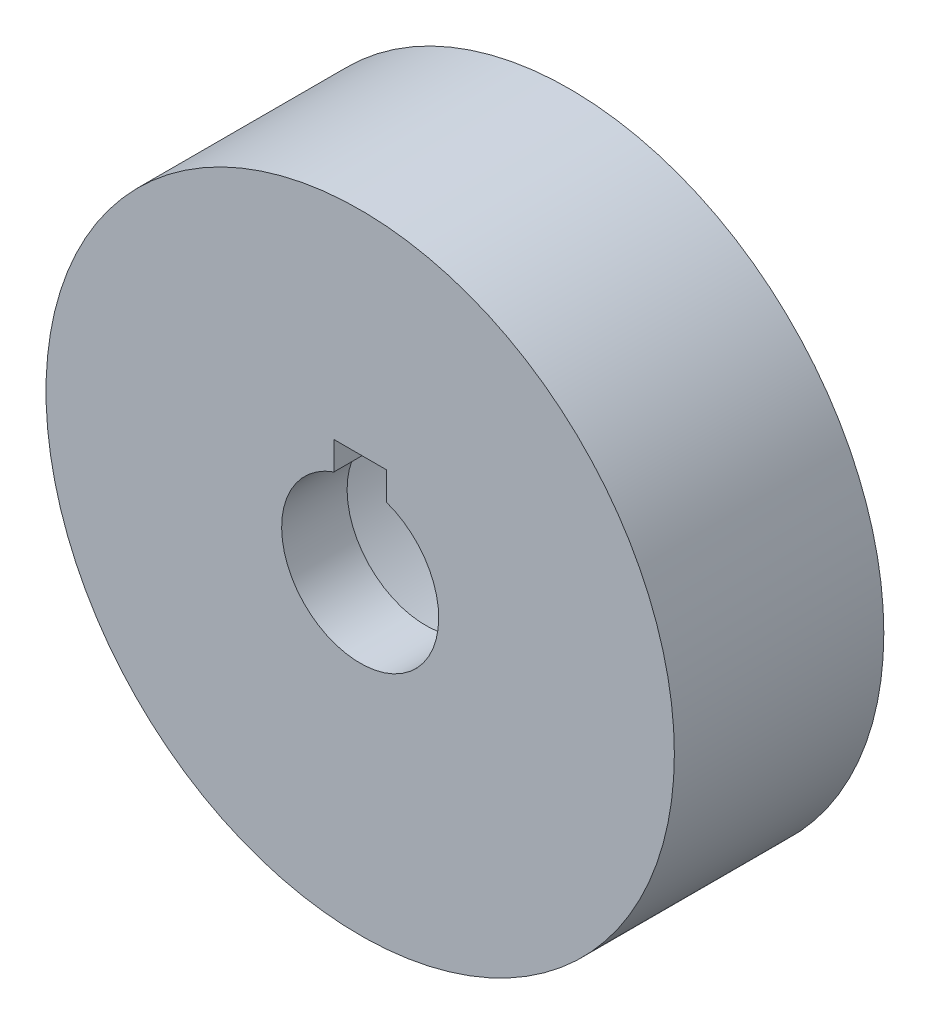
from build123d import *

# Parameters (mm, degrees)
SKETCH1_R                       = 24
BOSS_EXTRUDE1_DEPTH             = 5
BOSS_EXTRUDE2_START             = -11
SKETCH1_3_R                     = 24
SKETCH1_3_R_2                   = 15.5
BOSS_EXTRUDE2_DEPTH             = 11
TAP_DRILL_FOR_M5X0_8_TAP1_D     = 4.2
TAP_DRILL_FOR_M5X0_8_TAP1_DEPTH = 10
TAP_DRILL_FOR_M5X0_8_TAP1_TIP   = 1.2618073


with BuildPart() as part:
    # Sketch1 → Boss-Extrude1 (new body)
    with BuildSketch(Plane.XY):
        Circle(SKETCH1_R)
        with BuildLine():
            Line((-2, 7.8), (2, 7.8))
            Line((2, 7.8), (2, 5.656854249))
            ThreePointArc((2, 5.656854249), (0, -6), (-2, 5.656854249))
            Line((-2, 5.656854249), (-2, 7.8))
        make_face(mode=Mode.SUBTRACT)
    extrude(amount=BOSS_EXTRUDE1_DEPTH)

    # Sketch1<3> → Boss-Extrude2 (add)
    with BuildSketch(Plane.XY.offset(BOSS_EXTRUDE2_START)):
        Circle(SKETCH1_3_R)
        Circle(SKETCH1_3_R_2, mode=Mode.SUBTRACT)
    extrude(amount=BOSS_EXTRUDE2_DEPTH)

    # Tap Drill for M5x0.8 Tap1
    with Locations(Plane(origin=(0, 0, -11), x_dir=(-1, 0, 0), z_dir=(0, 0, -1))):
        with Locations((-19.75, 0), (0, -19.75), (19.75, 0), (0, 19.75)):
            Hole(TAP_DRILL_FOR_M5X0_8_TAP1_D / 2, depth=TAP_DRILL_FOR_M5X0_8_TAP1_DEPTH)
            with Locations((0, 0, -(TAP_DRILL_FOR_M5X0_8_TAP1_DEPTH + TAP_DRILL_FOR_M5X0_8_TAP1_TIP / 2))):  # 118° drill point
                Cone(0, TAP_DRILL_FOR_M5X0_8_TAP1_D / 2, TAP_DRILL_FOR_M5X0_8_TAP1_TIP, mode=Mode.SUBTRACT)


solid = part.part
